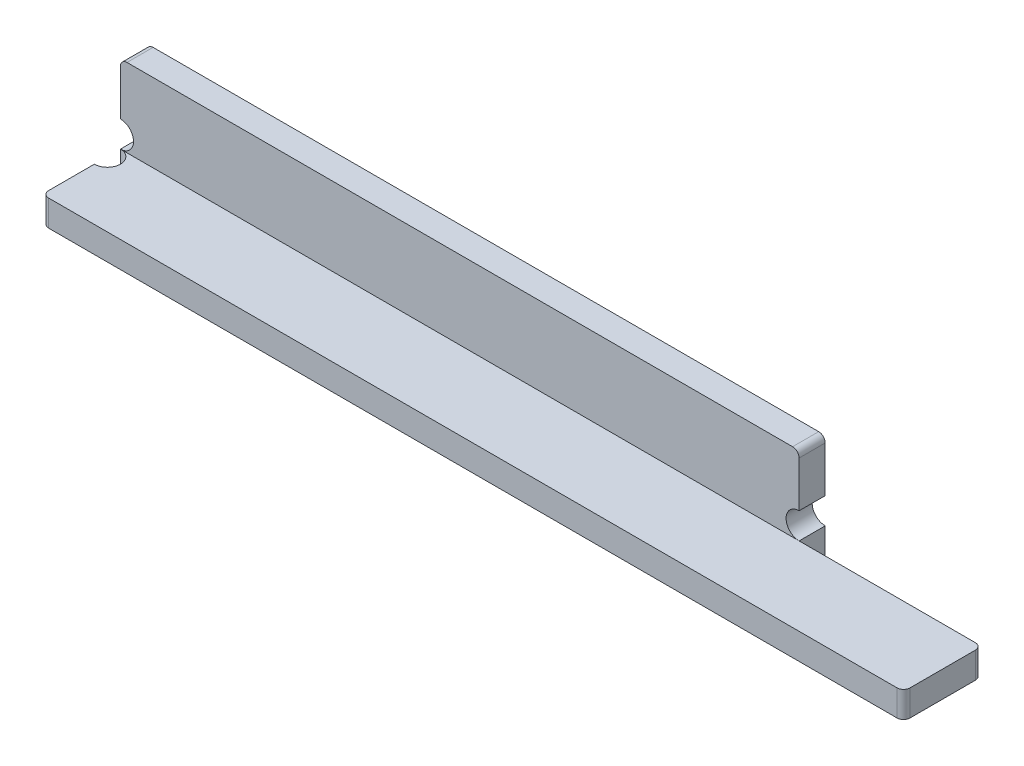
from build123d import *

# Parameters (mm, degrees)
BASE_DEPTH                = 5
SKETCH2_W                 = 130
SKETCH2_H                 = 5
MIDDLE_EXTRUSION_DEPTH    = 15
FANCY_CUTOUT_DEPTH        = 167.602070815
FANCY_CUTOUT_MIDDLE_DEPTH = 168.406690428
OVERALL_FILLETS_R         = 1.25


with BuildPart() as part:
    # Sketch1 → base (new body)
    with BuildSketch(Plane(origin=(0, 0, 0), x_dir=(1, 0, 0), z_dir=(0, 1, 0))):
        Polygon((0, 0), (0, 17.5), (85, 17.5), (85, 2.5), (130, 2.5), (130, -2.5), (165, -2.5), (165, -17.5), (0, -17.5), align=None)
    extrude(amount=BASE_DEPTH)

    # Sketch2 → middle_extrusion (add)
    with BuildSketch(Plane(origin=(0, 5, 0), x_dir=(1, 0, 0), z_dir=(0, 1, 0))):
        with Locations((65, 0)):
            Rectangle(SKETCH2_W, SKETCH2_H)
    extrude(amount=MIDDLE_EXTRUSION_DEPTH)

    # Sketch3 → fancy_cutout (cut, through all)
    with BuildSketch(Plane(origin=(0, 5, 0), x_dir=(1, 0, 0), z_dir=(0, 1, 0))):
        with BuildLine():
            Line((0, -7.5), (0, -2.5))
            ThreePointArc((0, -2.5), (2.5, -5), (0, -7.5))
        make_face()
        with BuildLine():
            Line((0, 2.5), (0, 7.5))
            ThreePointArc((0, 7.5), (2.5, 5), (0, 2.5))
        make_face()
        with BuildLine():
            Line((85, 2.5), (85, 7.5))
            ThreePointArc((85, 7.5), (82.5, 5), (85, 2.5))
        make_face()
    extrude(amount=-FANCY_CUTOUT_DEPTH, mode=Mode.SUBTRACT)

    # Sketch4 → fancy_cutout_middle (cut, through all)
    with BuildSketch(Plane.XY.offset(2.5)):
        with BuildLine():
            Line((0, 5), (0, 10))
            ThreePointArc((0, 10), (2.5, 7.5), (0, 5))
        make_face()
        with BuildLine():
            Line((130, 5), (130, 10))
            ThreePointArc((130, 10), (127.5, 7.5), (130, 5))
        make_face()
    extrude(amount=-FANCY_CUTOUT_MIDDLE_DEPTH, mode=Mode.SUBTRACT)

    # overall_fillets
    overall_fillets_edges = [part.edges().sort_by_distance(p)[0] for p in [
        (0, 2.5, -17.5),
        (85, 2.5, -17.5),
        (165, 2.5, 2.5),
        (165, 2.5, 17.5),
        (0, 2.5, 17.5),
        (130, 20, 0),
        (0, 20, 0),
    ]]
    fillet(overall_fillets_edges, radius=OVERALL_FILLETS_R)


solid = part.part
